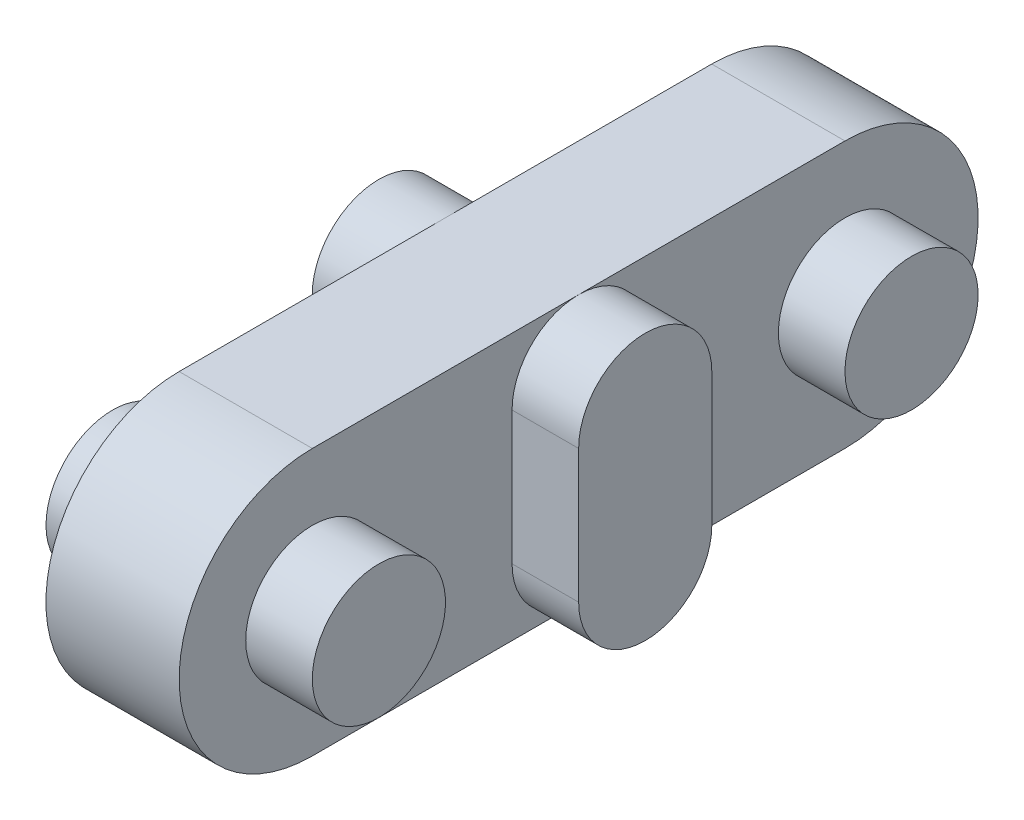
from build123d import *

# Parameters (mm, degrees)
BOSS_EXTRUDE1_DEPTH = 5.002296298
BOSS_EXTRUDE2_REACH = 34.501
BOSS_EXTRUDE3_REACH = 35.167
SKETCH4_W           = 2.497703702
SKETCH4_H           = 2.5
SKETCH5_W           = 2.5
SKETCH5_H           = 2.5
SKETCH6_W           = 2.5
SKETCH6_H           = 2.5
SKETCH7_W           = 2.497703702
SKETCH7_H           = 2.5


with BuildPart() as part:
    # Sketch1 → Boss-Extrude1 (new body)
    with BuildSketch(Plane(origin=(5.002296298, 0, 0), x_dir=(0, 0, -1), z_dir=(1, 0, 0))):
        with BuildLine():
            Line((-5, 0), (-25, 0))
            ThreePointArc((-25, 0), (-30, -5), (-25, -10))
            Line((-25, -10), (-5, -10))
            ThreePointArc((-5, -10), (0, -5), (-5, 0))
        make_face()
    extrude(amount=-BOSS_EXTRUDE1_DEPTH)

    # Sketch2 → Boss-Extrude2 (add, up to next)
    with BuildSketch(Plane(origin=(7.502296298, 0, 0), x_dir=(0, 0, -1), z_dir=(1, 0, 0)), mode=Mode.PRIVATE) as boss_extrude2_sk1:
        with BuildLine():
            Line((-17.5, -2.5), (-17.5, -7.5))
            ThreePointArc((-17.5, -7.5), (-15, -10), (-12.5, -7.5))
            Line((-12.5, -7.5), (-12.5, -2.5))
            ThreePointArc((-12.5, -2.5), (-15, 0), (-17.5, -2.5))
        make_face()
    boss_extrude2_tool1 = extrude(boss_extrude2_sk1.sketch, amount=-BOSS_EXTRUDE2_REACH, mode=Mode.PRIVATE) - part.part
    add(boss_extrude2_tool1.solids().sort_by_distance((7.502296, -5, 15))[0])

    # Sketch3 → Boss-Extrude3 (add, up to next)
    with BuildSketch(Plane(origin=(-2.5, 0, 0), x_dir=(0, -1, 0), z_dir=(-1, 0, 0)), mode=Mode.PRIVATE) as boss_extrude3_sk1:
        with BuildLine():
            Line((7.5, 17.5), (2.5, 17.5))
            ThreePointArc((2.5, 17.5), (0, 15), (2.5, 12.5))
            Line((2.5, 12.5), (7.5, 12.5))
            ThreePointArc((7.5, 12.5), (10, 15), (7.5, 17.5))
        make_face()
    boss_extrude3_tool1 = extrude(boss_extrude3_sk1.sketch, amount=-BOSS_EXTRUDE3_REACH, mode=Mode.PRIVATE) - part.part
    add(boss_extrude3_tool1.solids().sort_by_distance((-2.5, -5, 15))[0])

    # Sketch4 → Revolve1 (revolve)
    with BuildSketch(Plane(origin=(0, 0, 5), x_dir=(-1, 0, 0), z_dir=(0, 0, -1)), mode=Mode.PRIVATE) as revolve1_sk:
        with Locations((1.248851851, -3.75)):
            Rectangle(SKETCH4_W, SKETCH4_H)
    revolve(revolve1_sk.sketch.rotate(Axis((0, -5, 5), (-1, 0, 0)), 270), axis=Axis((0, -5, 5), (-1, 0, 0)))

    # Sketch5 → Revolve2 (revolve)
    with BuildSketch(Plane(origin=(0, 0, 5), x_dir=(-1, 0, 0), z_dir=(0, 0, -1)), mode=Mode.PRIVATE) as revolve2_sk:
        with Locations((-6.252296298, -3.75)):
            Rectangle(SKETCH5_W, SKETCH5_H)
    revolve(revolve2_sk.sketch.rotate(Axis((7.502296298, -5, 5), (-1, 0, 0)), 270), axis=Axis((7.502296298, -5, 5), (-1, 0, 0)))

    # Sketch6 → Revolve3 (revolve)
    with BuildSketch(Plane(origin=(0, 0, 25), x_dir=(-1, 0, 0), z_dir=(0, 0, -1)), mode=Mode.PRIVATE) as revolve3_sk:
        with Locations((-6.252296298, -3.75)):
            Rectangle(SKETCH6_W, SKETCH6_H)
    revolve(revolve3_sk.sketch.rotate(Axis((7.502296298, -5, 25), (-1, 0, 0)), 270), axis=Axis((7.502296298, -5, 25), (-1, 0, 0)))

    # Sketch7 → Revolve4 (revolve)
    with BuildSketch(Plane(origin=(0, 0, 25), x_dir=(-1, 0, 0), z_dir=(0, 0, -1)), mode=Mode.PRIVATE) as revolve4_sk:
        with Locations((1.248851851, -3.75)):
            Rectangle(SKETCH7_W, SKETCH7_H)
    revolve(revolve4_sk.sketch.rotate(Axis((0, -5, 25), (-1, 0, 0)), 270), axis=Axis((0, -5, 25), (-1, 0, 0)))


solid = part.part
